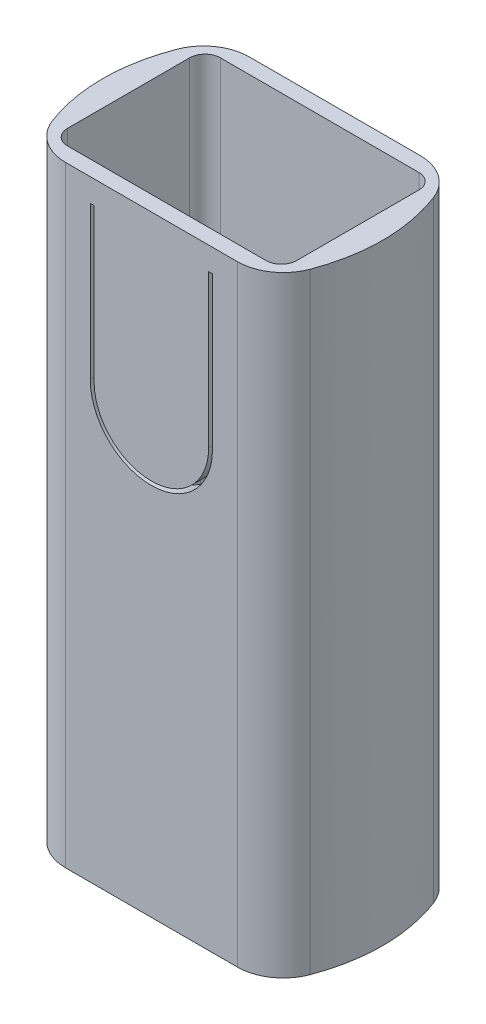
from build123d import *

# Parameters (mm, degrees)
BOSS_EXTRUDE4_DEPTH = 80
BOSS_EXTRUDE5_DEPTH = 57
CUT_EXTRUDE1_DEPTH  = 3


with BuildPart() as part:
    # Sketch8 → Boss-Extrude4 (new body)
    with BuildSketch(Plane(origin=(0, 58, 0), x_dir=(1, 0, 0), z_dir=(0, 1, 0))):
        with BuildLine():
            Line((-11.242998334, -12), (11.242998334, -12))
            ThreePointArc((11.242998334, -12), (14.65898123, -10.932652517), (16.859617211, -8.110353618))
            add(Edge.make_bspline(
                [(16.859617211, -8.110353618), (17.850691543, -5.472650271), (18.834301198, 0.028433299), (17.819526576, 5.426475932), (16.811684839, 8.109721769)],
                knots=[0.167422492, 0.167422492, 0.167422492, 0.167422492, 0.502499344, 0.837905074, 0.837905074, 0.837905074, 0.837905074], degree=3))
            ThreePointArc((16.811684839, 8.109721769), (14.611088933, 10.932460371), (11.194828596, 12))
            Line((11.194828596, 12), (-11.194828596, 12))
            ThreePointArc((-11.194828596, 12), (-14.611088933, 10.932460371), (-16.811684839, 8.109721769))
            add(Edge.make_bspline(
                [(-16.859617211, -8.110353618), (-17.850691543, -5.472650271), (-18.834301198, 0.028433299), (-17.819526576, 5.426475932), (-16.811684839, 8.109721769)],
                knots=[0.167422492, 0.167422492, 0.167422492, 0.167422492, 0.502499344, 0.837905074, 0.837905074, 0.837905074, 0.837905074], degree=3))
            ThreePointArc((-16.859617211, -8.110353618), (-14.65898123, -10.932652517), (-11.242998334, -12))
        make_face()
        with BuildLine():
            Line((-13, -10), (13, -10))
            ThreePointArc((13, -10), (14.414213562, -9.414213562), (15, -8))
            Line((15, -8), (15, 8))
            ThreePointArc((15, 8), (14.414213562, 9.414213562), (13, 10))
            Line((13, 10), (-13, 10))
            ThreePointArc((-13, 10), (-14.414213562, 9.414213562), (-15, 8))
            Line((-15, 8), (-15, -8))
            ThreePointArc((-15, -8), (-14.414213562, -9.414213562), (-13, -10))
        make_face(mode=Mode.SUBTRACT)
    extrude(amount=BOSS_EXTRUDE4_DEPTH)

    # Sketch11 → Boss-Extrude5 (add)
    with BuildSketch(Plane(origin=(0, 58, 0), x_dir=(1, 0, 0), z_dir=(0, 1, 0))):
        with BuildLine():
            Line((13, 10), (15, 10))
            Line((15, 10), (15, 6.937911183))
            Line((15, 6.937911183), (13.5, 6.937911183))
            ThreePointArc((13.5, 6.937911183), (13.146446609, 7.084357793), (13, 7.437911183))
            Line((13, 7.437911183), (13, 10))
        make_face()
        with BuildLine():
            Line((-13, 7.437911183), (-13, 10))
            Line((-13, 10), (-15, 10))
            Line((-15, 10), (-15, 6.937911183))
            Line((-15, 6.937911183), (-13.5, 6.937911183))
            ThreePointArc((-13.5, 6.937911183), (-13.146446609, 7.084357793), (-13, 7.437911183))
        make_face()
    extrude(amount=BOSS_EXTRUDE5_DEPTH)

    # Sketch12 → Cut-Extrude1 (cut)
    with BuildSketch(Plane.XY.offset(12)):
        with BuildLine():
            Line((7.476357736, 134.986611492), (7.476357736, 114.986611492))
            ThreePointArc((7.476357736, 114.986611492), (-0.023642264, 107.486611492), (-7.523642264, 114.986611492))
            Line((-7.523642264, 114.986611492), (-7.523642264, 134.986611492))
            Line((-7.523642264, 134.986611492), (-8.023642264, 134.986611492))
            Line((-8.023642264, 134.986611492), (-8.023642264, 114.986611492))
            ThreePointArc((-8.023642264, 114.986611492), (-0.023642264, 106.986611492), (7.976357736, 114.986611492))
            Line((7.976357736, 114.986611492), (7.976357736, 134.986611492))
            Line((7.976357736, 134.986611492), (7.476357736, 134.986611492))
        make_face()
    extrude(amount=-CUT_EXTRUDE1_DEPTH, mode=Mode.SUBTRACT)


solid = part.part
